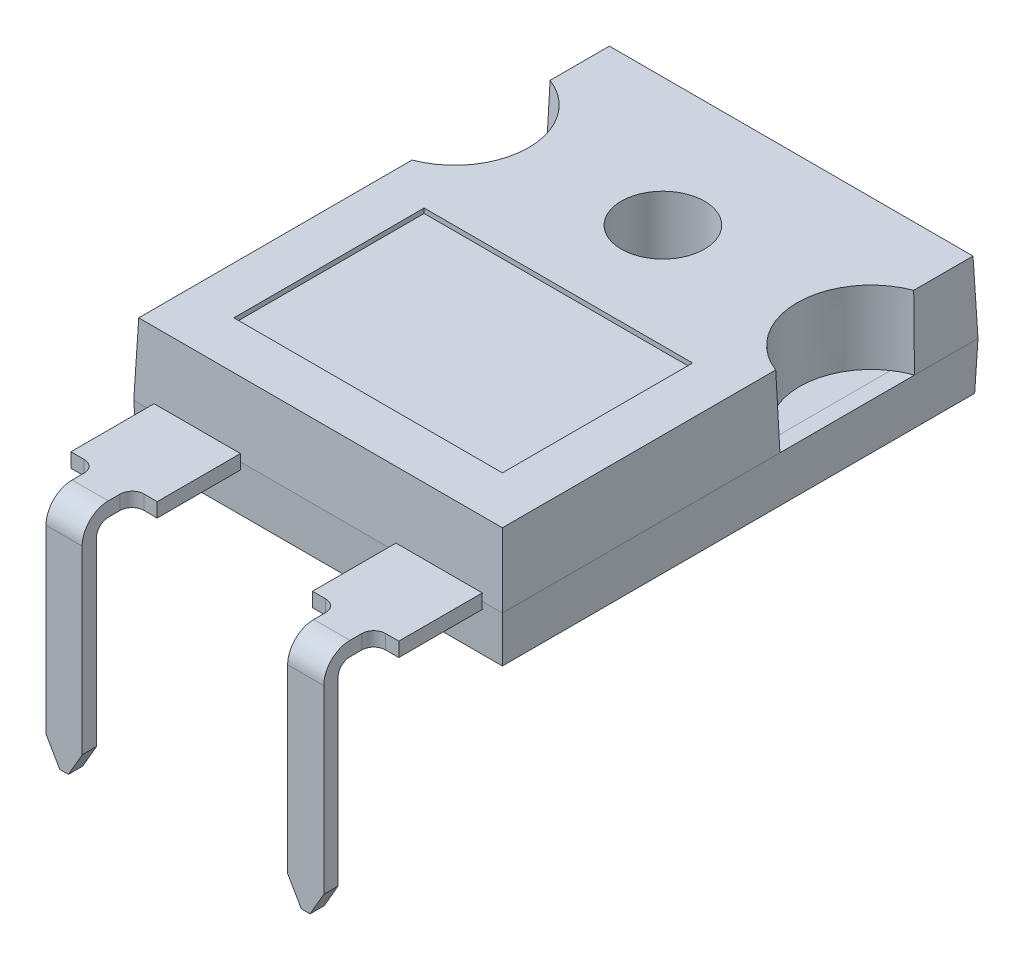
from build123d import *
from OCP.BRepFilletAPI import BRepFilletAPI_MakeChamfer

# Parameters (mm, degrees)
SKETCH1_W                   = 15.5
SKETCH1_H                   = 20
EXTRUDE1_DEPTH              = 2
EXTRUDE1_DRAFT              = -2
EXTRUDE2_DEPTH              = 3
EXTRUDE2_TAPER              = 2
SKETCH3_R                   = 1.75
EXTRUDE3_DEPTH              = 18.184658986
SKETCH4_W                   = 3.63
SKETCH4_H                   = 3.5
EXTRUDE4_DEPTH              = 0.3
SKETCH4_H_2                 = 4
EXTRUDE4_2_DEPTH            = 0.3
SKETCH5_W                   = 11.290475384
SKETCH5_H                   = 8
EXTRUDE5_DEPTH              = 0.2
SKETCH6_W                   = 1.52
SKETCH6_H                   = 0.6
CHAMFER1_SIZE               = 1
CHAMFER1_SIZE2              = 0.577350269
LPATTERN1_COUNT             = 2
LPATTERN1_PITCH             = 10.16
CHAMFER1_OF_LPATTERN1_SIZE  = 1
CHAMFER1_OF_LPATTERN1_SIZE2 = 0.577350269
SKETCH7_R                   = 3.25
CUT_EXTRUDE1_DEPTH          = 2
SKETCH8_R                   = 3.25
EXTRUDE7_DEPTH              = 2
FILLET2_R                   = 0.5
FILLET3_R                   = 0.5


with BuildPart() as part:
    # Sketch1 → Extrude1 (with draft: the straight prism first)
    with BuildSketch(Plane(origin=(0, 0, 0), x_dir=(1, 0, 0), z_dir=(0, 1, 0))):
        with Locations((0, -4.5)):
            Rectangle(SKETCH1_W, SKETCH1_H)
    extrude(amount=-EXTRUDE1_DEPTH)
    # Extrude1: the draft: its side faces are tilted about the plane it starts from
    extrude1_sides = [part.faces().sort_by_distance(p)[0] for p in [
        (7.75, -1, 4.5),
        (0, -1, -5.5),
        (-7.75, -1, 4.5),
        (0, -1, 14.5),
    ]]
    draft(extrude1_sides, Plane(origin=(0, 0, 0), x_dir=(1, 0, 0), z_dir=(0, 1, 0)), EXTRUDE1_DRAFT)

    # Sketch2 → Extrude2 (add)
    with BuildSketch(Plane(origin=(0, 0, 0), x_dir=(1, 0, 0), z_dir=(0, 1, 0))):
        with BuildLine():
            Line((-7.75, -2.828427125), (-7.75, -14.5))
            Line((-7.75, -14.5), (7.75, -14.5))
            Line((7.75, -14.5), (7.75, -2.828427125))
            ThreePointArc((7.75, -2.828427125), (5.75, 0), (7.75, 2.828427125))
            Line((7.75, 2.828427125), (7.75, 5.5))
            Line((7.75, 5.5), (-7.75, 5.5))
            Line((-7.75, 5.5), (-7.75, 2.828427125))
            ThreePointArc((-7.75, 2.828427125), (-5.75, 0), (-7.75, -2.828427125))
        make_face()
    extrude(amount=EXTRUDE2_DEPTH, taper=EXTRUDE2_TAPER)

    # Sketch3 → Extrude3 (cut, through all)
    with BuildSketch(Plane(origin=(0, 3, 0), x_dir=(1, 0, 0), z_dir=(0, 1, 0))):
        with Locations(Location((0, 0, 0), (0, 0, 270))):
            Circle(SKETCH3_R)
    extrude(amount=-EXTRUDE3_DEPTH, mode=Mode.SUBTRACT)

    # Sketch5 → Extrude5 (cut)
    with BuildSketch(Plane(origin=(0, 3, 0), x_dir=(1, 0, 0), z_dir=(0, 1, 0))):
        with Locations((0, -8.395237692)):
            Rectangle(SKETCH5_W, SKETCH5_H)
    extrude(amount=-EXTRUDE5_DEPTH, mode=Mode.SUBTRACT)

    # Sketch7 → Cut-Extrude1 (cut)
    with BuildSketch(Plane.XZ.offset(2)):
        with BuildLine():
            Line((-7.080158461, 12.830158461), (-7.080158461, -3.830158461))
            ThreePointArc((-7.080158461, -3.830158461), (-6.787265242, -4.537265242), (-6.080158461, -4.830158461))
            Line((-6.080158461, -4.830158461), (6.080158461, -4.830158461))
            ThreePointArc((6.080158461, -4.830158461), (6.787265242, -4.537265242), (7.080158461, -3.830158461))
            Line((7.080158461, -3.830158461), (7.080158461, 12.830158461))
            ThreePointArc((7.080158461, 12.830158461), (6.787265242, 13.537265242), (6.080158461, 13.830158461))
            Line((6.080158461, 13.830158461), (-6.080158461, 13.830158461))
            ThreePointArc((-6.080158461, 13.830158461), (-6.787265242, 13.537265242), (-7.080158461, 12.830158461))
        make_face()
        with Locations(Location((0, 0, 0), (0, 0, 270))):
            Circle(SKETCH7_R, mode=Mode.SUBTRACT)
    extrude(amount=-CUT_EXTRUDE1_DEPTH, mode=Mode.SUBTRACT)


with BuildPart() as body_2:
    # Sketch4 → Extrude4 (new, symmetric)
    with BuildSketch(Plane(origin=(0, 0, 0), x_dir=(1, 0, 0), z_dir=(0, 1, 0))):
        with Locations((-5.08, -16.25)):
            Rectangle(SKETCH4_W, SKETCH4_H)
    extrude(amount=EXTRUDE4_DEPTH, both=True)

    # Sweep1: sweep along a curve in space
    with BuildLine() as sweep1_path:
        Line((-5.5, 0, 18), (-5.5, 0, 19))
        ThreePointArc((-5.5, 0, 19), (-5.5, -0.234314575, 19.565685425), (-5.5, -0.8, 19.8))
        Line((-5.5, -0.8, 19.8), (-5.5, -9.4, 19.8))
    # Sketch6 → Sweep1 (sweep)
    with BuildSketch(Plane.XY.offset(18)):
        with Locations((-5.08, 0)):
            Rectangle(SKETCH6_W, SKETCH6_H)
    sweep1 = sweep(path=sweep1_path.line)

    # Chamfer1: one chamfer whose edges measure the first distance from different faces: ONE call of the kernel's chamfer builder (chamfer() names one face for all edges)
    chamfer1_edges_1 = [body_2.edges().sort_by_distance(p)[0] for p in [
        (-5.84, -9.4, 19.8),
    ]]
    chamfer1_side_1 = [body_2.faces().sort_by_distance(p)[0] for p in [
        (-5.84, -4.07081027, 19.649372357),
    ]]
    chamfer1_edges_2 = [body_2.edges().sort_by_distance(p)[0] for p in [
        (-4.32, -9.4, 19.8),
    ]]
    chamfer1_side_2 = [body_2.faces().sort_by_distance(p)[0] for p in [
        (-4.32, -4.07081027, 19.649372357),
    ]]
    chamfer1 = BRepFilletAPI_MakeChamfer(body_2.part.solid().wrapped)
    for e in chamfer1_edges_1:
        chamfer1.Add(CHAMFER1_SIZE, CHAMFER1_SIZE2, e.wrapped, chamfer1_side_1[0].wrapped)  # the first distance lies on this face
    for e in chamfer1_edges_2:
        chamfer1.Add(CHAMFER1_SIZE, CHAMFER1_SIZE2, e.wrapped, chamfer1_side_2[0].wrapped)  # the first distance lies on this face
    add(Compound.cast(chamfer1.Shape()), mode=Mode.REPLACE)

    # Fillet2
    fillet2_edges = [body_2.edges().sort_by_distance(p)[0] for p in [
        (-4.32, 0, 18),
        (-5.84, 0, 18),
    ]]
    fillet(fillet2_edges, radius=FILLET2_R)


with BuildPart() as body_3:
    # Sketch4 → Extrude4 2 (new, symmetric)
    with BuildSketch(Plane(origin=(0, 0, 0), x_dir=(1, 0, 0), z_dir=(0, 1, 0))):
        with Locations((5.08, -16)):
            Rectangle(SKETCH4_W, SKETCH4_H_2)
    extrude(amount=EXTRUDE4_2_DEPTH, both=True)

    # LPattern1: Sweep1 ×2
    with Locations(*[(i * LPATTERN1_PITCH, 0, 0) for i in range(1, LPATTERN1_COUNT)]):
        add(sweep1)

    # Chamfer1 of LPattern1: one chamfer whose edges measure the first distance from different faces: ONE call of the kernel's chamfer builder (chamfer() names one face for all edges)
    chamfer1_of_lpattern1_edges_1 = [body_3.edges().sort_by_distance(p)[0] for p in [
        (4.32, -9.4, 19.8),
    ]]
    chamfer1_of_lpattern1_side_1 = [body_3.faces().sort_by_distance(p)[0] for p in [
        (4.32, -4.07081027, 19.649372357),
    ]]
    chamfer1_of_lpattern1_edges_2 = [body_3.edges().sort_by_distance(p)[0] for p in [
        (5.84, -9.4, 19.8),
    ]]
    chamfer1_of_lpattern1_side_2 = [body_3.faces().sort_by_distance(p)[0] for p in [
        (5.84, -4.07081027, 19.649372357),
    ]]
    chamfer1_of_lpattern1 = BRepFilletAPI_MakeChamfer(body_3.part.solid().wrapped)
    for e in chamfer1_of_lpattern1_edges_1:
        chamfer1_of_lpattern1.Add(CHAMFER1_OF_LPATTERN1_SIZE, CHAMFER1_OF_LPATTERN1_SIZE2, e.wrapped, chamfer1_of_lpattern1_side_1[0].wrapped)  # the first distance lies on this face
    for e in chamfer1_of_lpattern1_edges_2:
        chamfer1_of_lpattern1.Add(CHAMFER1_OF_LPATTERN1_SIZE, CHAMFER1_OF_LPATTERN1_SIZE2, e.wrapped, chamfer1_of_lpattern1_side_2[0].wrapped)  # the first distance lies on this face
    add(Compound.cast(chamfer1_of_lpattern1.Shape()), mode=Mode.REPLACE)

    # Fillet3
    fillet3_edges = [body_3.edges().sort_by_distance(p)[0] for p in [
        (5.84, 0, 18),
        (4.32, 0, 18),
    ]]
    fillet(fillet3_edges, radius=FILLET3_R)


with BuildPart() as body_4:
    # Sketch8 → Extrude7 (new body)
    with BuildSketch(Plane.XZ.offset(2)):
        with BuildLine():
            Line((-7.080158461, 12.830158461), (-7.080158461, -3.830158461))
            ThreePointArc((-7.080158461, -3.830158461), (-6.787265242, -4.537265242), (-6.080158461, -4.830158461))
            Line((-6.080158461, -4.830158461), (6.080158461, -4.830158461))
            ThreePointArc((6.080158461, -4.830158461), (6.787265242, -4.537265242), (7.080158461, -3.830158461))
            Line((7.080158461, -3.830158461), (7.080158461, 12.830158461))
            ThreePointArc((7.080158461, 12.830158461), (6.787265242, 13.537265242), (6.080158461, 13.830158461))
            Line((6.080158461, 13.830158461), (-6.080158461, 13.830158461))
            ThreePointArc((-6.080158461, 13.830158461), (-6.787265242, 13.537265242), (-7.080158461, 12.830158461))
        make_face()
        with Locations(Location((0, 0, 0), (0, 0, 270))):
            Circle(SKETCH8_R, mode=Mode.SUBTRACT)
    extrude(amount=-EXTRUDE7_DEPTH)


solid = Compound([part.part, body_2.part, body_3.part, body_4.part])
